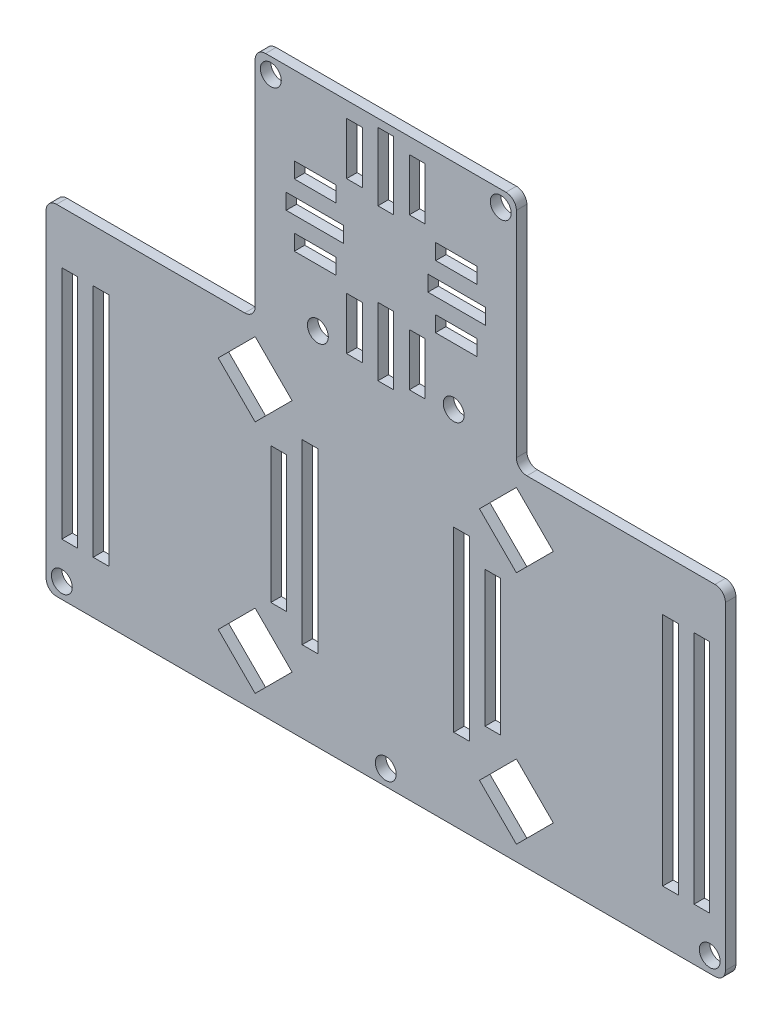
from build123d import *

# Parameters (mm, degrees)
SKETCH1_W           = 50
SKETCH1_H           = 45
BOSS_EXTRUDE1_DEPTH = 2
FILLET1_R           = 2
SKETCH3_W           = 3
SKETCH3_H           = 10
SKETCH3_W_2         = 7.936264089
SKETCH3_H_2         = 3
SKETCH3_W_3         = 11
SKETCH3_H_3         = 1.470363465
SKETCH3_H_4         = 1.529636535
SKETCH3_W_4         = 7.991276849
SKETCH3_H_5         = 45
CUT_EXTRUDE1_DEPTH  = 2
SKETCH4_R           = 2
CUT_EXTRUDE2_DEPTH  = 10


with BuildPart() as part:
    # Sketch1 → Boss-Extrude1 (new body)
    with BuildSketch(Plane.XY):
        Polygon((-65, -32.5), (65, -32.5), (65, 32.5), (25, 32.5), (25, -12.5), (-25, -12.5), (-25, 32.5), (-65, 32.5), align=None)
        with Locations((0, 55)):
            Rectangle(SKETCH1_W, SKETCH1_H)
        with Locations((0, 10)):
            Rectangle(SKETCH1_W, SKETCH1_H)
    extrude(amount=BOSS_EXTRUDE1_DEPTH)

    # Fillet1
    fillet1_edges = [part.edges().sort_by_distance(p)[0] for p in [
        (65, 32.5, 1),
        (65, -32.5, 1),
        (-65, -32.5, 1),
        (-65, 32.5, 1),
        (-25, 32.5, 1),
        (-25, 77.5, 1),
        (25, 77.5, 1),
        (25, 32.5, 1),
    ]]
    fillet(fillet1_edges, radius=FILLET1_R)

    # Sketch3 → Cut-Extrude1 (cut)
    with BuildSketch(Plane(origin=(0, 0, 0), x_dir=(-1, 0, 0), z_dir=(0, 0, -1))):
        with Locations((6, 40.5)):
            Rectangle(SKETCH3_W, SKETCH3_H)
        with Locations((-6, 40.5)):
            Rectangle(SKETCH3_W, SKETCH3_H)
        Polygon((-1.5, 34), (0, 34), (0, 47), (-1.5, 47), (-1.5, 45.5), (-1.5, 35.5), align=None)
        Polygon((0, 47), (0, 34), (1.5, 34), (1.5, 35.5), (1.5, 45.5), (1.5, 47), align=None)
        with Locations((-6, 69.5)):
            Rectangle(SKETCH3_W, SKETCH3_H)
        Polygon((-1.5, 63), (0, 63), (0, 76), (-1.5, 76), (-1.5, 74.5), (-1.5, 64.5), align=None)
        Polygon((0, 76), (0, 63), (1.5, 63), (1.5, 64.5), (1.5, 74.5), (1.5, 76), align=None)
        with Locations((6, 69.5)):
            Rectangle(SKETCH3_W, SKETCH3_H)
        with Locations((13.531867956, 60.94842354)):
            Rectangle(SKETCH3_W_2, SKETCH3_H_2)
        with Locations((13.563735911, 55.735181733)):
            Rectangle(SKETCH3_W_3, SKETCH3_H_3)
        with Locations((13.563735911, 54.235181733)):
            Rectangle(SKETCH3_W_3, SKETCH3_H_4)
        with Locations((13.504361575, 48.970363465)):
            Rectangle(SKETCH3_W_4, SKETCH3_H_2)
        with Locations((-13.531867956, 60.94842354)):
            Rectangle(SKETCH3_W_2, SKETCH3_H_2)
        with Locations((-13.563735911, 55.735181733)):
            Rectangle(SKETCH3_W_3, SKETCH3_H_3)
        with Locations((-13.563735911, 54.235181733)):
            Rectangle(SKETCH3_W_3, SKETCH3_H_4)
        with Locations((-13.504361575, 48.970363465)):
            Rectangle(SKETCH3_W_4, SKETCH3_H_2)
        Polygon((-25, 15.428932188), (-17.928932188, 22.5), (-25, 29.571067812), (-32.071067812, 22.5), align=None)
        Polygon((-19, -13), (-19, 13), (-22, 13), (-22, 0), (-22, -13), align=None)
        Polygon((-13, 17), (-13, -17), (-16, -17), (-16, 13), (-16, 17), align=None)
        Polygon((-25, -29.571067812), (-17.928932188, -22.5), (-25, -15.428932188), (-32.071067812, -22.5), align=None)
        with Locations((-54.5, 0)):
            Rectangle(SKETCH3_W, SKETCH3_H_5)
        Polygon((-59, -22.5), (-59, 22.5), (-62, 22.5), (-62, 0), (-62, -22.5), align=None)
        Polygon((25, 29.571067812), (32.071067812, 22.5), (25, 15.428932188), (17.928932188, 22.5), align=None)
        Polygon((22, 0), (22, -13), (19, -13), (19, 13), (22, 13), align=None)
        Polygon((13, 17), (13, -17), (16, -17), (16, 13), (16, 17), align=None)
        Polygon((25, -15.428932188), (32.071067812, -22.5), (25, -29.571067812), (17.928932188, -22.5), align=None)
        Polygon((62, 0), (62, -22.5), (59, -22.5), (59, 22.5), (62, 22.5), align=None)
        with Locations((54.5, 0)):
            Rectangle(SKETCH3_W, SKETCH3_H_5)
    extrude(amount=-CUT_EXTRUDE1_DEPTH, mode=Mode.SUBTRACT)

    # Sketch4 → Cut-Extrude2 (cut)
    with BuildSketch(Plane.XY.offset(2)):
        with Locations((0, -29.5)):
            Circle(SKETCH4_R)
        with Locations((-62, -29.5)):
            Circle(SKETCH4_R)
        with Locations((-13, 36.5)):
            Circle(SKETCH4_R)
        with Locations((13, 36.5)):
            Circle(SKETCH4_R)
        with Locations((62, -29.5)):
            Circle(SKETCH4_R)
        with Locations((22, 74.5)):
            Circle(SKETCH4_R)
        with Locations((-22, 74.5)):
            Circle(SKETCH4_R)
    extrude(amount=-CUT_EXTRUDE2_DEPTH, mode=Mode.SUBTRACT)


solid = part.part
